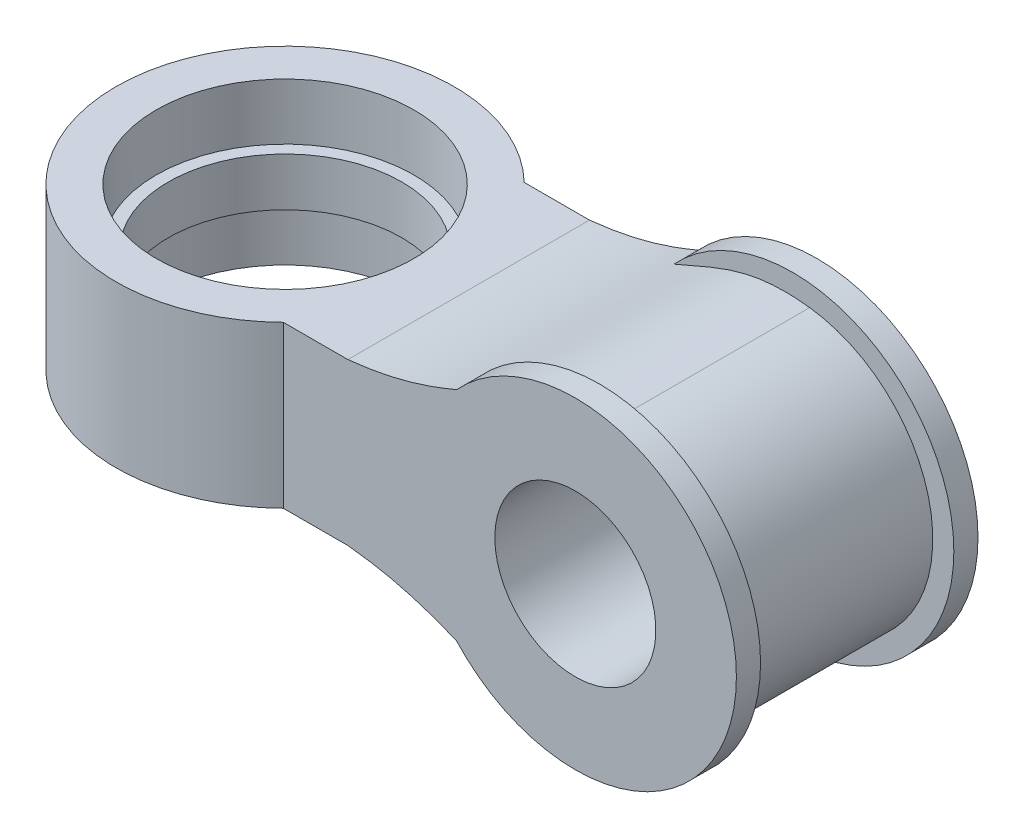
from build123d import *

# Parameters (mm, degrees)
SKETCH1_R                = 20
BOSS_EXTRUDE1_DEPTH      = 3
BOSS_EXTRUDE2_DEPTH      = 30
BOSS_EXTRUDE3_START      = -3
SKETCH3_R                = 20
BOSS_EXTRUDE3_DEPTH      = 3
SKETCH4_R                = 10
CUT_EXTRUDE1_DEPTH       = 43
SKETCH6_R                = 21
SKETCH6_R_2              = 16
BOSS_EXTRUDE4_DEPTH      = 20
SKETCH7_R                = 16
CUT_EXTRUDE2_DEPTH       = 20
BOSS_EXTRUDE5_DEPTH      = 3
BOSS_EXTRUDE5_DEPTH_BACK = 3
SKETCH8_R                = 21
SKETCH8_R_2              = 14.5


with BuildPart() as part:
    # Sketch1 → Boss-Extrude1 (new body)
    with BuildSketch(Plane.XY):
        Circle(SKETCH1_R)
    extrude(amount=BOSS_EXTRUDE1_DEPTH)

    # Sketch2 → Boss-Extrude2 (add)
    with BuildSketch(Plane(origin=(0, 0, 0), x_dir=(-1, 0, 0), z_dir=(0, 0, -1))):
        with BuildLine():
            Line((40, 10), (40, -10))
            Line((40, -10), (28.244450832, -10))
            add(Edge.make_bspline(
                [(28.244450832, -10), (12.990267169, -11.555535356), (9.900933724, -18.719511351), (-2.100622964, -17.258760722)],
                knots=[0, 0, 0, 0, 1, 1, 1, 1], degree=3))
            ThreePointArc((-2.100622964, -17.258760722), (-17.38612776, 0), (-2.100622964, 17.258760722))
            add(Edge.make_bspline(
                [(28.244450832, 10), (12.990267169, 11.555535356), (9.900933724, 18.719511351), (-2.100622964, 17.258760722)],
                knots=[0, 0, 0, 0, 1, 1, 1, 1], degree=3))
            Line((28.244450832, 10), (40, 10))
        make_face()
    extrude(amount=-BOSS_EXTRUDE2_DEPTH)

    # Sketch3 → Boss-Extrude3 (add)
    with BuildSketch(Plane.XY.offset(30).offset(BOSS_EXTRUDE3_START)):
        Circle(SKETCH3_R)
    extrude(amount=BOSS_EXTRUDE3_DEPTH)

    # Sketch4 → Cut-Extrude1 (cut)
    with BuildSketch(Plane(origin=(0, 0, 0), x_dir=(-1, 0, 0), z_dir=(0, 0, -1))):
        Circle(SKETCH4_R)
    extrude(amount=-CUT_EXTRUDE1_DEPTH, mode=Mode.SUBTRACT)

    # Sketch6 → Boss-Extrude4 (add)
    with BuildSketch(Plane(origin=(0, 10, 0), x_dir=(1, 0, 0), z_dir=(0, 1, 0))):
        with Locations((-51, -15.043878404)):
            Circle(SKETCH6_R)
        with Locations((-51, -15.043878404)):
            Circle(SKETCH6_R_2, mode=Mode.SUBTRACT)
    extrude(amount=-BOSS_EXTRUDE4_DEPTH)

    # Sketch7 → Cut-Extrude2 (cut)
    with BuildSketch(Plane(origin=(0, 10, 0), x_dir=(1, 0, 0), z_dir=(0, 1, 0))):
        with Locations(Location((-51, -15.043878404, 0), (0, 0, 180))):
            Circle(SKETCH7_R)
    extrude(amount=-CUT_EXTRUDE2_DEPTH, mode=Mode.SUBTRACT)

    # Sketch8 → Boss-Extrude5 (add, two sides: drawn at the far end of the back side and taken through both)
    with BuildSketch(Plane(origin=(0, 0, 0), x_dir=(1, 0, 0), z_dir=(0, 1, 0)).offset(-BOSS_EXTRUDE5_DEPTH_BACK)):
        with Locations((-51, -15.043878404)):
            Circle(SKETCH8_R)
        with Locations(Location((-51, -15.043878404, 0), (0, 0, 270))):
            Circle(SKETCH8_R_2, mode=Mode.SUBTRACT)
    extrude(amount=BOSS_EXTRUDE5_DEPTH + BOSS_EXTRUDE5_DEPTH_BACK)


solid = part.part
